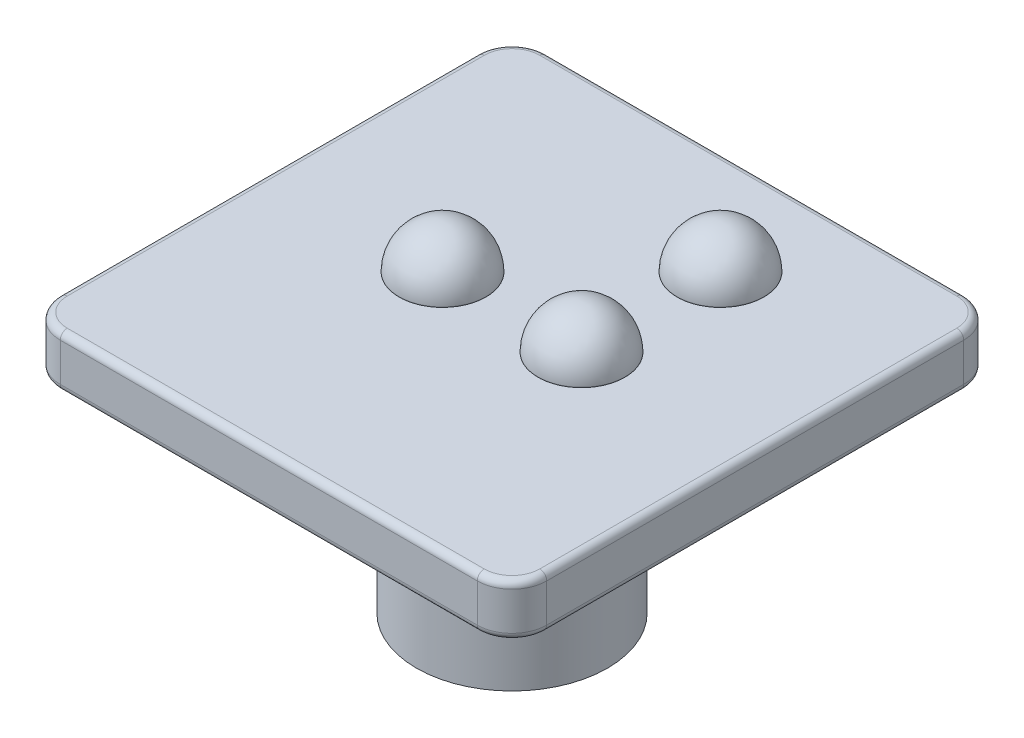
from build123d import *

# Parameters (mm, degrees)
BOSS_EXTRUDE1_DEPTH = 1.5
SKETCH2_R           = 2.75
BOSS_EXTRUDE2_DEPTH = 6
SKETCH3_W           = 1.1
SKETCH3_H           = 1.45
SKETCH3_W_2         = 1.45
SKETCH3_H_2         = 1.1
CUT_EXTRUDE1_DEPTH  = 6
CHAMFER1_SIZE       = 0.3
FILLET1_R           = 1
SKETCH4_R           = 1.25
BOSS_EXTRUDE3_DEPTH = 0.01
DOME2_FACE_RADIUS   = 1.25
DOME2_HEIGHT        = 1.25
DOME3_FACE_RADIUS   = 1.25
DOME3_HEIGHT        = 1.25
DOME4_FACE_RADIUS   = 1.25
DOME4_HEIGHT        = 1.25
FILLET3_R           = 0.2


with BuildPart() as part:
    # Sketch1 → Boss-Extrude1 (new body)
    with BuildSketch(Plane(origin=(0, 0, 0), x_dir=(1, 0, 0), z_dir=(0, 1, 0))):
        with BuildLine():
            Line((-7.324675649, 4.396717546), (4.675324351, 4.396717546))
            ThreePointArc((4.675324351, 4.396717546), (5.382431132, 4.103824327), (5.675324351, 3.396717546))
            Line((5.675324351, 3.396717546), (5.675324351, -8.603282454))
            ThreePointArc((5.675324351, -8.603282454), (5.382431132, -9.310389235), (4.675324351, -9.603282454))
            Line((4.675324351, -9.603282454), (-7.324675649, -9.603282454))
            ThreePointArc((-7.324675649, -9.603282454), (-8.03178243, -9.310389235), (-8.324675649, -8.603282454))
            Line((-8.324675649, -8.603282454), (-8.324675649, 3.396717546))
            ThreePointArc((-8.324675649, 3.396717546), (-8.03178243, 4.103824327), (-7.324675649, 4.396717546))
        make_face()
    extrude(amount=BOSS_EXTRUDE1_DEPTH)

    # Sketch2 → Boss-Extrude2 (add)
    with BuildSketch(Plane.XZ):
        with Locations(Location((-1.324675649, 2.603282454, 0), (0, 0, 270))):
            Circle(SKETCH2_R)
    extrude(amount=BOSS_EXTRUDE2_DEPTH)

    # Sketch3 → Cut-Extrude1 (cut)
    with BuildSketch(Plane.XZ.offset(6)):
        with Locations((-1.324675649, 3.878282454)):
            Rectangle(SKETCH3_W, SKETCH3_H)
        with Locations((-0.049675649, 2.603282454)):
            Rectangle(SKETCH3_W_2, SKETCH3_H_2)
        with Locations((-1.324675649, 2.603282454)):
            Rectangle(SKETCH3_W, SKETCH3_H_2)
        with Locations((-2.599675649, 2.603282454)):
            Rectangle(SKETCH3_W_2, SKETCH3_H_2)
        with Locations((-1.324675649, 1.328282454)):
            Rectangle(SKETCH3_W, SKETCH3_H)
    extrude(amount=-CUT_EXTRUDE1_DEPTH, mode=Mode.SUBTRACT)

    # Chamfer1
    chamfer1_edges = [part.edges().sort_by_distance(p)[0] for p in [
        (-0.774675649, -6, 3.878282454),
        (-0.049675649, -6, 3.153282454),
        (0.675324351, -6, 2.603282454),
        (-0.774675649, -6, 1.328282454),
        (-2.599675649, -6, 3.153282454),
        (-1.324675649, -6, 4.603282454),
        (-1.874675649, -6, 3.878282454),
        (-3.324675649, -6, 2.603282454),
        (-2.599675649, -6, 2.053282454),
        (-1.874675649, -6, 1.328282454),
        (-1.324675649, -6, 0.603282454),
        (-0.049675649, -6, 2.053282454),
    ]]
    chamfer(chamfer1_edges, length=CHAMFER1_SIZE)

    # Fillet1
    fillet1_edges = [part.edges().sort_by_distance(p)[0] for p in [
        (-1.324675649, 0, 5.353282454),
    ]]
    fillet(fillet1_edges, radius=FILLET1_R)

    # Sketch4 → Boss-Extrude3 (add)
    with BuildSketch(Plane(origin=(0, 1.5, 0), x_dir=(1, 0, 0), z_dir=(0, 1, 0))):
        with Locations(Location((0.675324351, -2.603282454, 0), (0, 0, 90))):
            Circle(SKETCH4_R)
        with Locations(Location((-3.324675649, -2.603282454, 0), (0, 0, 90))):
            Circle(SKETCH4_R)
        with Locations(Location((0.675324351, 1.396717546, 0), (0, 0, 90))):
            Circle(SKETCH4_R)
    extrude(amount=BOSS_EXTRUDE3_DEPTH)

    # Dome2: a dome of height H over a round flat face of radius A is a cap of a sphere of radius (A * A + H * H) / (2 * H)
    dome2_r = (DOME2_FACE_RADIUS * DOME2_FACE_RADIUS + DOME2_HEIGHT * DOME2_HEIGHT) / (2 * DOME2_HEIGHT)
    dome2_base = Plane((0.675324351, 1.51, -1.396717546), z_dir=(0, 1, 0))
    with Locations(dome2_base.offset(DOME2_HEIGHT - dome2_r)):
        dome2_ball = Sphere(dome2_r, mode=Mode.PRIVATE)
    add(split(dome2_ball, bisect_by=dome2_base, keep=Keep.TOP, mode=Mode.PRIVATE))

    # Dome3: a dome of height H over a round flat face of radius A is a cap of a sphere of radius (A * A + H * H) / (2 * H)
    dome3_r = (DOME3_FACE_RADIUS * DOME3_FACE_RADIUS + DOME3_HEIGHT * DOME3_HEIGHT) / (2 * DOME3_HEIGHT)
    dome3_base = Plane((-3.324675649, 1.51, 2.603282454), z_dir=(0, 1, 0))
    with Locations(dome3_base.offset(DOME3_HEIGHT - dome3_r)):
        dome3_ball = Sphere(dome3_r, mode=Mode.PRIVATE)
    add(split(dome3_ball, bisect_by=dome3_base, keep=Keep.TOP, mode=Mode.PRIVATE))

    # Dome4: a dome of height H over a round flat face of radius A is a cap of a sphere of radius (A * A + H * H) / (2 * H)
    dome4_r = (DOME4_FACE_RADIUS * DOME4_FACE_RADIUS + DOME4_HEIGHT * DOME4_HEIGHT) / (2 * DOME4_HEIGHT)
    dome4_base = Plane((0.675324351, 1.51, 2.603282454), z_dir=(0, 1, 0))
    with Locations(dome4_base.offset(DOME4_HEIGHT - dome4_r)):
        dome4_ball = Sphere(dome4_r, mode=Mode.PRIVATE)
    add(split(dome4_ball, bisect_by=dome4_base, keep=Keep.TOP, mode=Mode.PRIVATE))

    # Fillet3
    fillet3_edges = [part.edges().sort_by_distance(p)[0] for p in [
        (5.382431132, 1.5, 9.310389235),
        (-1.324675649, 0, 9.603282454),
        (-8.03178243, 0, 9.310389235),
        (5.675324351, 1.5, 2.603282454),
        (5.382431132, 1.5, -4.103824327),
        (-1.324675649, 1.5, -4.396717546),
        (-8.03178243, 1.5, -4.103824327),
        (-8.324675649, 1.5, 2.603282454),
        (-8.03178243, 1.5, 9.310389235),
        (-1.324675649, 1.5, 9.603282454),
        (-8.324675649, 0, 2.603282454),
        (-8.03178243, 0, -4.103824327),
        (-1.324675649, 0, -4.396717546),
        (5.382431132, 0, -4.103824327),
        (5.675324351, 0, 2.603282454),
        (5.382431132, 0, 9.310389235),
    ]]
    fillet(fillet3_edges, radius=FILLET3_R)


solid = part.part
